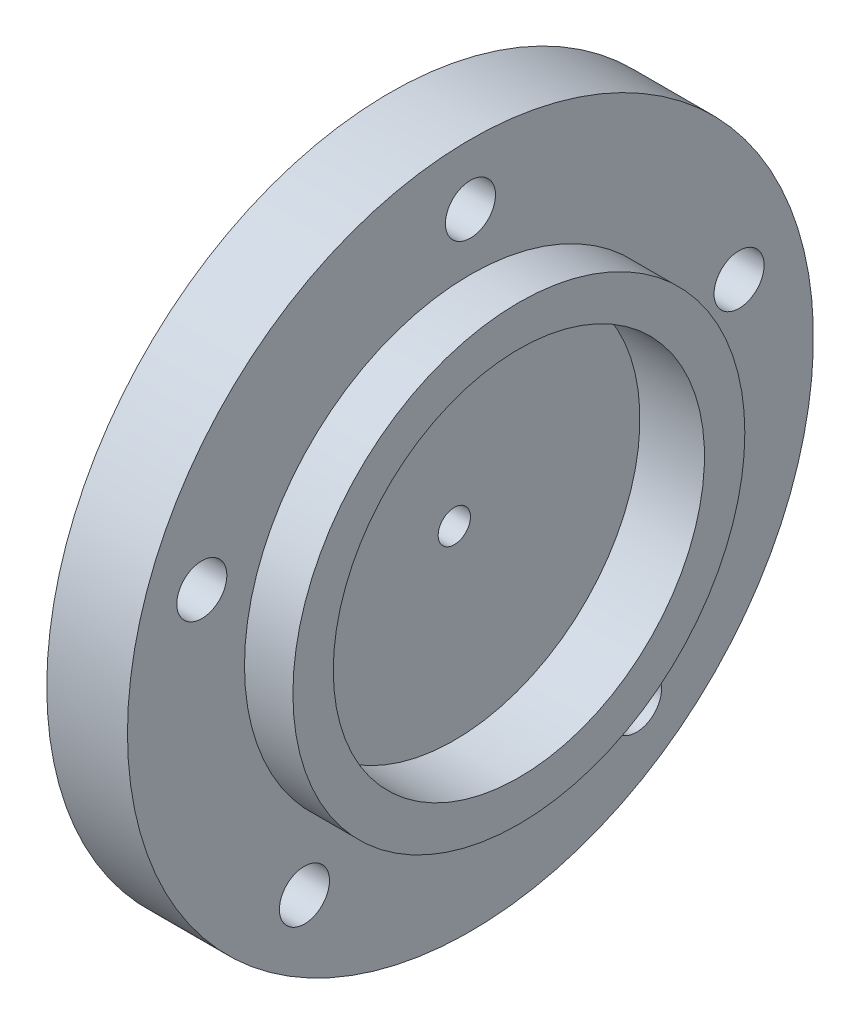
from build123d import *

# Parameters (mm, degrees)
HOLE_WIZARD_6_0_6_1_D = 6.2


with BuildPart() as part:
    # Эскиз1 → Повернуть1 (revolve)
    with BuildSketch(Plane.XY, mode=Mode.PRIVATE) as revolve_1_sk:
        Polygon((0, -2), (8, -2), (8, -23), (16, -23), (16, -28), (10, -28), (10, -42.5), (0, -42.5), align=None)
    revolve(revolve_1_sk.sketch.rotate(Axis((-696.045801993, 0, 0), (1, 0, 0)), 270), axis=Axis((-696.045801993, 0, 0), (1, 0, 0)))

    # Диаметр отверстия Ø6.0 (6)1 (through all)
    with Locations(Plane(origin=(0, 10.815594803, -33.28697807), x_dir=(0, 0, -1), z_dir=(-1, 0, 0))):
        with Locations((0, 0), (-66.57395614, 0), (-33.28697807, -24.184405197), (-12.71449424, 39.131189606), (-53.8594619, 39.131189606)):
            Hole(HOLE_WIZARD_6_0_6_1_D / 2)


solid = part.part
